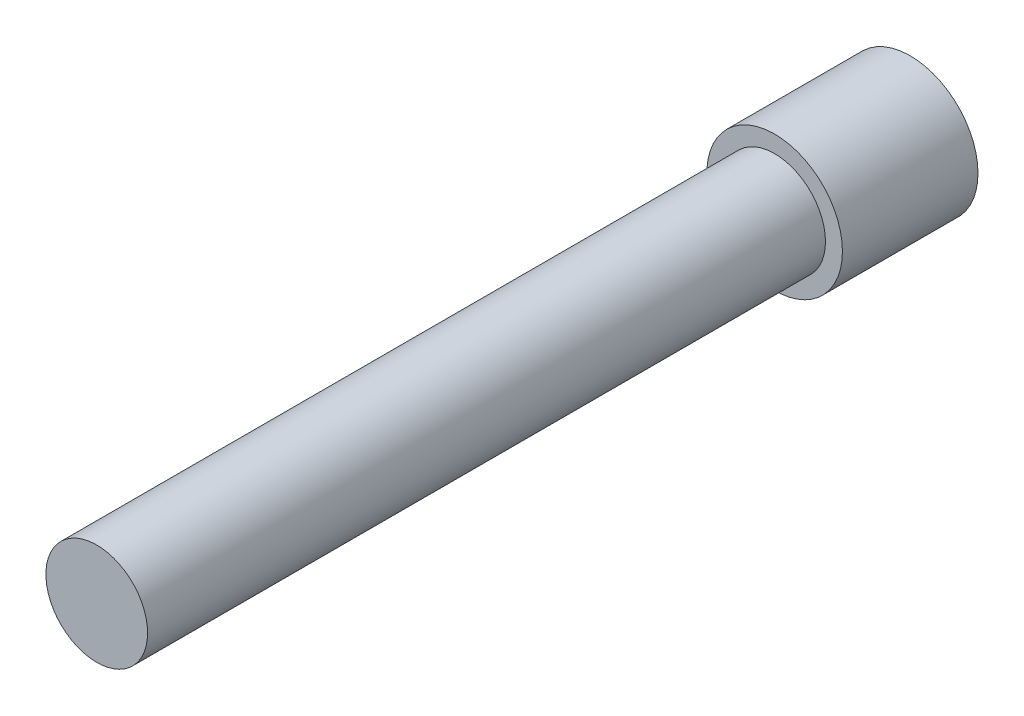
from build123d import *

# Parameters (mm, degrees)
SKETCH1_R           = 10
BOSS_EXTRUDE1_DEPTH = 20
SKETCH2_R           = 7.5
BOSS_EXTRUDE2_DEPTH = 100


with BuildPart() as part:
    # Sketch1 → Boss-Extrude1 (new body)
    with BuildSketch(Plane.XY):
        Circle(SKETCH1_R)
    extrude(amount=BOSS_EXTRUDE1_DEPTH)

    # Sketch2 → Boss-Extrude2 (add)
    with BuildSketch(Plane.XY.offset(20)):
        Circle(SKETCH2_R)
    extrude(amount=BOSS_EXTRUDE2_DEPTH)


solid = part.part
